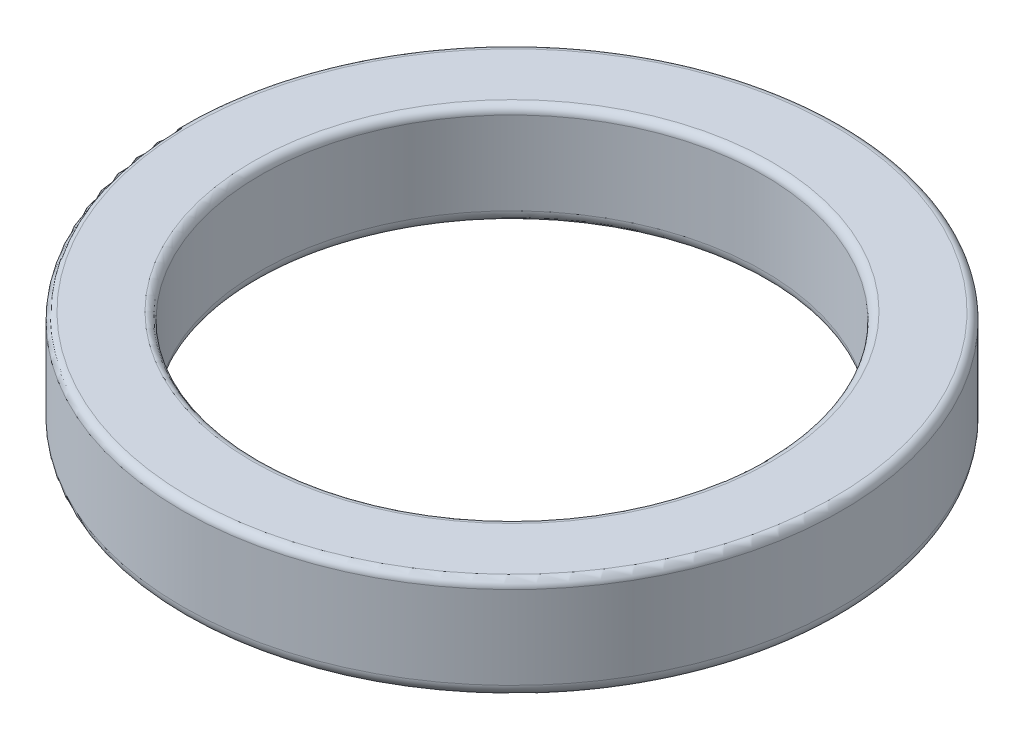
from build123d import *

# Parameters (mm, degrees)
SKETCH1_R           = 12.70845
SKETCH1_R_2         = 9.70845
BOSS_EXTRUDE1_DEPTH = 4
FILLET1_R           = 0.3
FILLET5_R           = 0.3
FILLET6_R           = 0.5
FILLET7_R           = 0.5


with BuildPart() as part:
    # Sketch1 → Boss-Extrude1 (new body)
    with BuildSketch(Plane(origin=(0, 0, 0), x_dir=(1, 0, 0), z_dir=(0, 1, 0))):
        with Locations(Location((0, 0, 0), (0, 0, 270))):
            Circle(SKETCH1_R)
        with Locations(Location((0, 0, 0), (0, 0, 270))):
            Circle(SKETCH1_R_2, mode=Mode.SUBTRACT)
    extrude(amount=BOSS_EXTRUDE1_DEPTH)

    # Fillet1
    fillet1_edges = [part.edges().sort_by_distance(p)[0] for p in [
        (0, 4, -12.70845),
    ]]
    fillet(fillet1_edges, radius=FILLET1_R)

    # Fillet5
    fillet5_edges = [part.edges().sort_by_distance(p)[0] for p in [
        (0, 4, -9.70845),
    ]]
    fillet(fillet5_edges, radius=FILLET5_R)

    # Fillet6
    fillet6_edges = [part.edges().sort_by_distance(p)[0] for p in [
        (0, 0, -12.70845),
    ]]
    fillet(fillet6_edges, radius=FILLET6_R)

    # Fillet7
    fillet7_edges = [part.edges().sort_by_distance(p)[0] for p in [
        (0, 0, -9.70845),
    ]]
    fillet(fillet7_edges, radius=FILLET7_R)


solid = part.part
